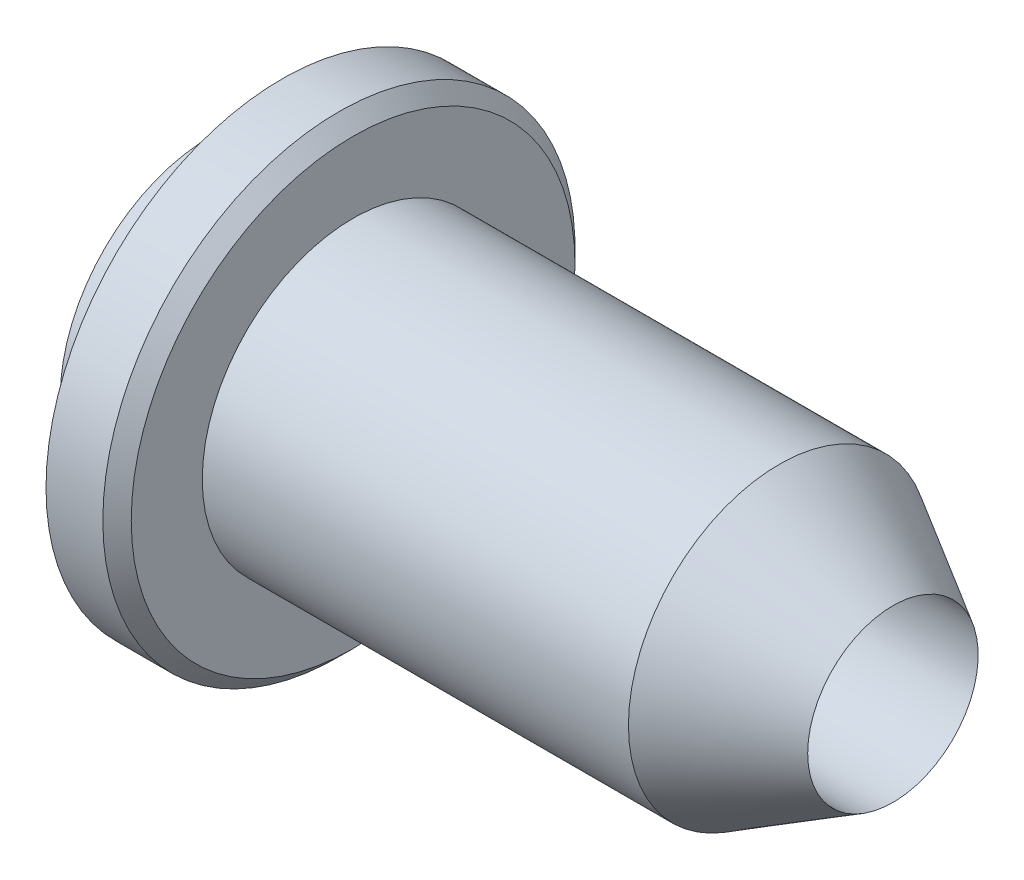
from build123d import *


with BuildPart() as part:
    # Sketch1 → Revolve1 (revolve)
    with BuildSketch(Plane.XY, mode=Mode.PRIVATE) as revolve1_sk:
        Polygon((10, 10.618802154), (10, 15.618802154), (9, 16.618802154), (5, 16.618802154), (5, 10.618802154), (0, 10.618802154), (0, 6), (48, 6), (40, 10.618802154), align=None)
    revolve(revolve1_sk.sketch.rotate(Axis((0, 0, 0), (1, 0, 0)), 90), axis=Axis((0, 0, 0), (1, 0, 0)))


solid = part.part
